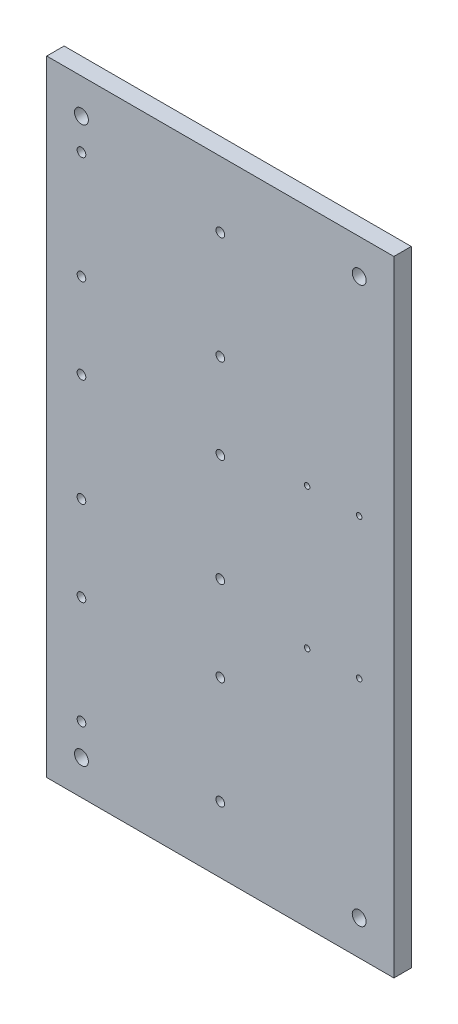
from build123d import *

# Parameters (mm, degrees)
ESQUISSE1_W             = 100
ESQUISSE1_H             = 180
BOSS_EXTRU_1_DEPTH      = 5
ESQUISSE2_R             = 1.25
ESQUISSE2_R_2           = 0.8
ESQUISSE2_R_3           = 2
ENL_V_MAT_EXTRU_1_DEPTH = 5


with BuildPart() as part:
    # Esquisse1 → Boss.-Extru.1 (new body)
    with BuildSketch(Plane.XY):
        with Locations((50, 90)):
            Rectangle(ESQUISSE1_W, ESQUISSE1_H)
    extrude(amount=BOSS_EXTRU_1_DEPTH)

    # Esquisse2 → Enlèv. mat.-Extru.1 (cut)
    with BuildSketch(Plane.XY.offset(5)):
        with Locations((10, 105.5)):
            Circle(ESQUISSE2_R)
        with Locations((50, 105.5)):
            Circle(ESQUISSE2_R)
        with Locations(Location((50, 74.5, 0), (0, 0, 180))):
            Circle(ESQUISSE2_R)
        with Locations(Location((10, 74.5, 0), (0, 0, 180))):
            Circle(ESQUISSE2_R)
        with Locations((10, 130)):
            Circle(ESQUISSE2_R)
        with Locations((50, 130)):
            Circle(ESQUISSE2_R)
        with Locations((50, 161)):
            Circle(ESQUISSE2_R)
        with Locations((10, 161)):
            Circle(ESQUISSE2_R)
        with Locations(Location((10, 19, 0), (0, 0, 180))):
            Circle(ESQUISSE2_R)
        with Locations(Location((50, 19, 0), (0, 0, 180))):
            Circle(ESQUISSE2_R)
        with Locations(Location((50, 50, 0), (0, 0, 180))):
            Circle(ESQUISSE2_R)
        with Locations(Location((10, 50, 0), (0, 0, 180))):
            Circle(ESQUISSE2_R)
        with Locations((75, 110.25)):
            Circle(ESQUISSE2_R_2)
        with Locations((90, 110.25)):
            Circle(ESQUISSE2_R_2)
        with Locations(Location((90, 69.75, 0), (0, 0, 180))):
            Circle(ESQUISSE2_R_2)
        with Locations(Location((75, 69.75, 0), (0, 0, 180))):
            Circle(ESQUISSE2_R_2)
        with Locations((90, 170)):
            Circle(ESQUISSE2_R_3)
        with Locations(Location((90, 10, 0), (0, 0, 180))):
            Circle(ESQUISSE2_R_3)
        with Locations(Location((10, 170, 0), (0, 0, 180))):
            Circle(ESQUISSE2_R_3)
        with Locations((10, 10)):
            Circle(ESQUISSE2_R_3)
    extrude(amount=-ENL_V_MAT_EXTRU_1_DEPTH, mode=Mode.SUBTRACT)


solid = part.part
